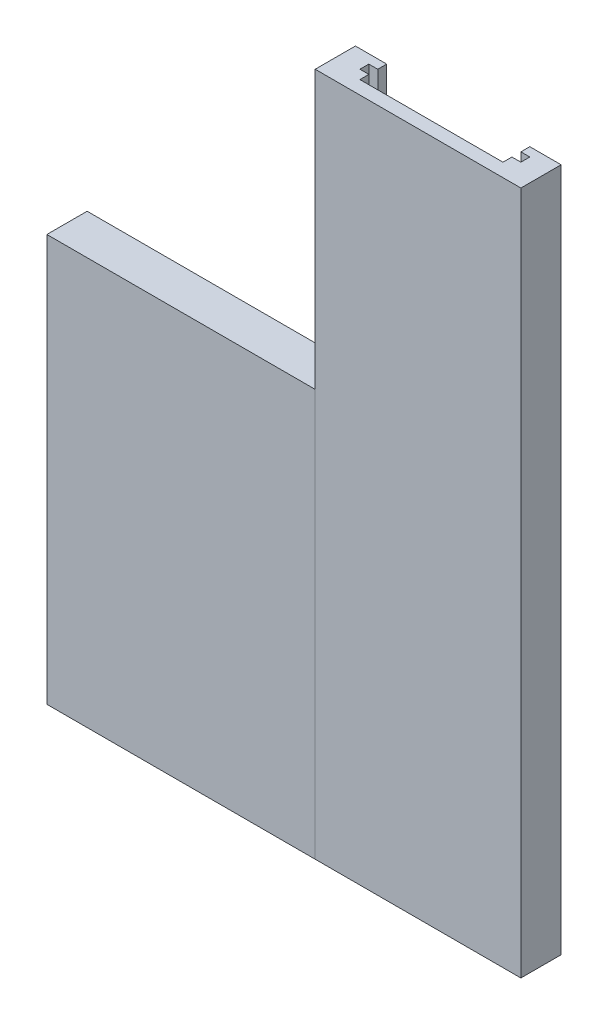
from build123d import *

# Parameters (mm, degrees)
P_IDAT_VYSUNUT_M1_DEPTH = 6
SKICA2_W                = 46
SKICA2_H                = 153
P_IDAT_VYSUNUT_M2_DEPTH = 3
SKICA5_W                = 60
SKICA5_H                = 91
P_IDAT_VYSUNUT_M4_DEPTH = 6
SKICA7_W                = 60
SKICA7_H                = 91
SKICA7_W_2              = 54
SKICA7_H_2              = 85
P_IDAT_VYSUNUT_M5_DEPTH = 3
P_IDAT_VYSUNUT_M6_DEPTH = 153


with BuildPart() as part:
    # Skica1 → Přidat vysunutím1 (new body)
    with BuildSketch(Plane.XY):
        Polygon((40, -3), (43, -3), (43, 150), (40, 150), (40, 0), (0, 0), (0, 150), (-3, 150), (-3, -3), (0, -3), align=None)
    extrude(amount=P_IDAT_VYSUNUT_M1_DEPTH)

    # Skica2 → Přidat vysunutím2 (add)
    with BuildSketch(Plane.XY.offset(6)):
        with Locations((20, 73.5)):
            Rectangle(SKICA2_W, SKICA2_H)
    extrude(amount=P_IDAT_VYSUNUT_M2_DEPTH)

    # Skica3 → Přidat vysunutím6 (add, through all)
    with BuildSketch(Plane.XZ.offset(3)):
        Polygon((0, 0), (4, 0), (4, 2), (2, 2), (2, 4), (4, 4), (4, 6), (0, 6), align=None)
        Polygon((40, 0), (36, 0), (36, 2), (38, 2), (38, 4), (36, 4), (36, 6), (40, 6), align=None)
    extrude(amount=-P_IDAT_VYSUNUT_M6_DEPTH)


with BuildPart() as body_2:
    # Skica5 → Přidat vysunutím4 (new body)
    with BuildSketch(Plane.XY.offset(9)):
        with Locations((-33, 42.5)):
            Rectangle(SKICA5_W, SKICA5_H)
    extrude(amount=-P_IDAT_VYSUNUT_M4_DEPTH)

    # Skica7 → Přidat vysunutím5 (add, through all)
    with BuildSketch(Plane(origin=(0, 0, 3), x_dir=(-1, 0, 0), z_dir=(0, 0, -1))):
        with Locations((33, 42.5)):
            Rectangle(SKICA7_W, SKICA7_H)
        with Locations((33, 42.5)):
            Rectangle(SKICA7_W_2, SKICA7_H_2, mode=Mode.SUBTRACT)
    extrude(amount=P_IDAT_VYSUNUT_M5_DEPTH)


solid = Compound([part.part, body_2.part])
